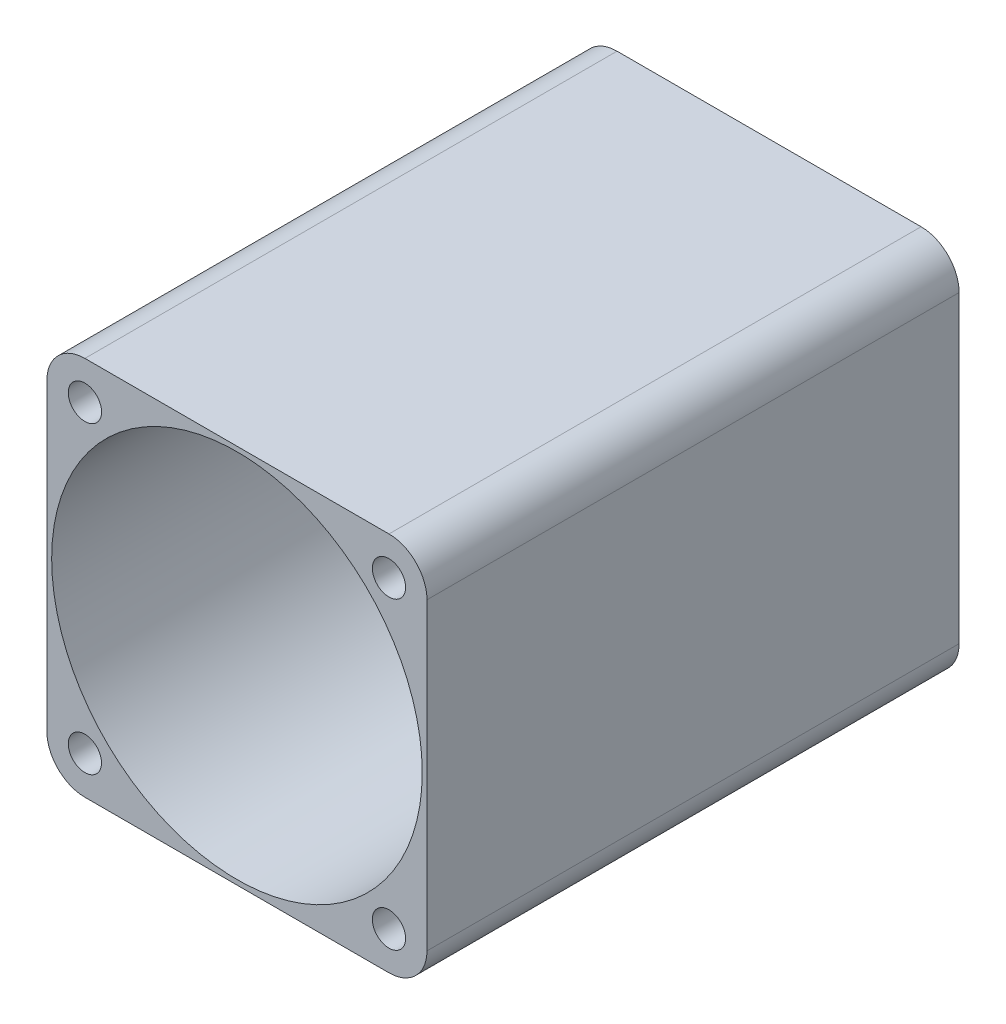
from build123d import *

# Parameters (mm, degrees)
SKETCH1_R           = 1.75
BOSS_EXTRUDE1_DEPTH = 56
SKETCH2_R           = 19.5
CUT_EXTRUDE1_DEPTH  = 56


with BuildPart() as part:
    # Sketch1 → Boss-Extrude1 (new body)
    with BuildSketch(Plane.XY):
        with BuildLine():
            Line((-16, -20), (16, -20))
            ThreePointArc((16, -20), (18.828427125, -18.828427125), (20, -16))
            Line((20, -16), (20, 16))
            ThreePointArc((20, 16), (18.828427125, 18.828427125), (16, 20))
            Line((16, 20), (-16, 20))
            ThreePointArc((-16, 20), (-18.828427125, 18.828427125), (-20, 16))
            Line((-20, 16), (-20, -16))
            ThreePointArc((-20, -16), (-18.828427125, -18.828427125), (-16, -20))
        make_face()
        with Locations((16, 16)):
            Circle(SKETCH1_R, mode=Mode.SUBTRACT)
        with Locations(Location((-16, 16, 0), (0, 0, 180))):
            Circle(SKETCH1_R, mode=Mode.SUBTRACT)
        with Locations(Location((16, -16, 0), (0, 0, 180))):
            Circle(SKETCH1_R, mode=Mode.SUBTRACT)
        with Locations((-16, -16)):
            Circle(SKETCH1_R, mode=Mode.SUBTRACT)
    extrude(amount=-BOSS_EXTRUDE1_DEPTH)

    # Sketch2 → Cut-Extrude1 (cut)
    with BuildSketch(Plane.XY):
        Circle(SKETCH2_R)
    extrude(amount=-CUT_EXTRUDE1_DEPTH, mode=Mode.SUBTRACT)


solid = part.part
